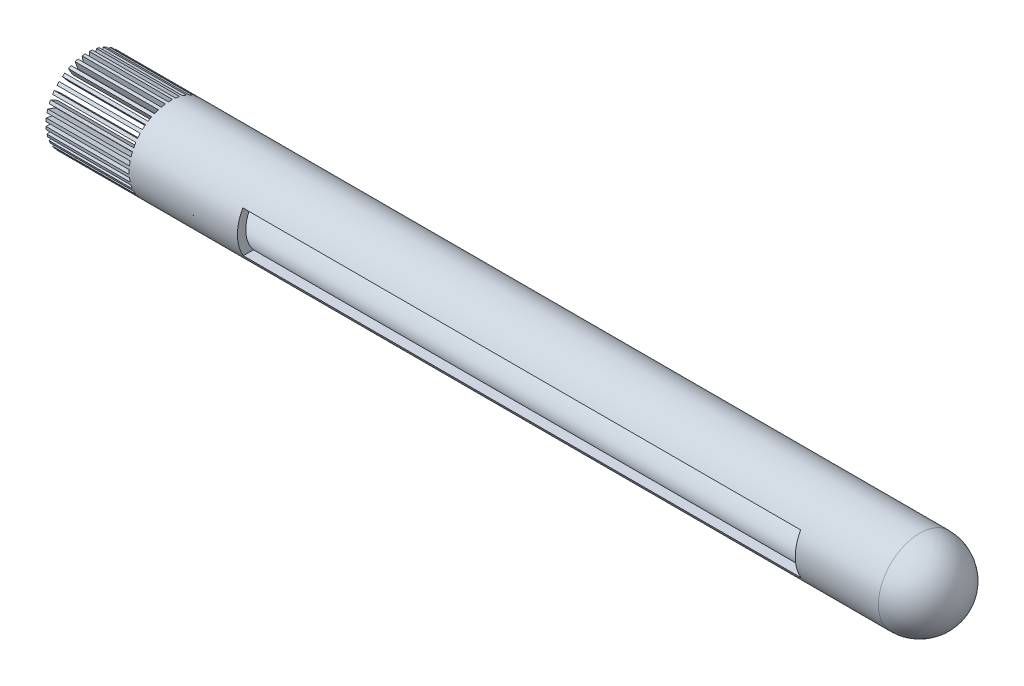
from build123d import *

# Parameters (mm, degrees)
SKETCH_2_W               = 67
SKETCH_2_H               = 5
CUT_EXTRUDE_7_DEPTH      = 5
SKETCH_4_W               = 2.478086938
SKETCH_4_H               = 0.5
CUT_EXTRUDE_8_DEPTH      = 10
PATTERN_CIRCULAR_1_COUNT = 36


with BuildPart() as part:
    # 草图1 one side (on Front Plane) → 旋转9 (revolve)
    with BuildSketch(Plane.XY):
        with BuildLine():
            Line((50.022066485, 4.958337107), (-49.9652163, 4.958337107))
            Line((-49.9652163, 4.958337107), (-49.9652163, 3.958337107))
            Line((-49.9652163, 3.958337107), (50.019735825, 3.958337107))
            ThreePointArc((50.019735825, 3.958337107), (52.820704557, 2.794539276), (53.999857419, 0))
            Line((53.999857419, 0), (54.999900891, 0))
            ThreePointArc((54.999900891, 0), (53.528639282, 3.500825799), (50.022066485, 4.958337107))
        make_face()
    revolve(axis=Axis((0, 0, 0), (1, 0, 0)))

    # 草图2 → 切除-拉伸7 (cut, symmetric)
    with BuildSketch(Plane.XY):
        with Locations((6.5347837, -0.041662893)):
            Rectangle(SKETCH_2_W, SKETCH_2_H)
    extrude(amount=CUT_EXTRUDE_7_DEPTH, both=True, mode=Mode.SUBTRACT)

    # 草图4 → 切除-拉伸8 (cut)
    with BuildSketch(Plane.ZY.offset(49.9652163)):
        with Locations((-4.5, 0)):
            Rectangle(SKETCH_4_W, SKETCH_4_H)
    cut_extrude_8 = extrude(amount=-CUT_EXTRUDE_8_DEPTH, mode=Mode.SUBTRACT)

    # 阵列(圆周)1: 切除-拉伸8 ×36 about axis
    pattern_circular_1_axis = Axis((0, 0, 0), (-1, 0, 0))
    for i in range(1, PATTERN_CIRCULAR_1_COUNT):
        add(cut_extrude_8.rotate(pattern_circular_1_axis, i * 360 / PATTERN_CIRCULAR_1_COUNT), mode=Mode.SUBTRACT)


solid = part.part
